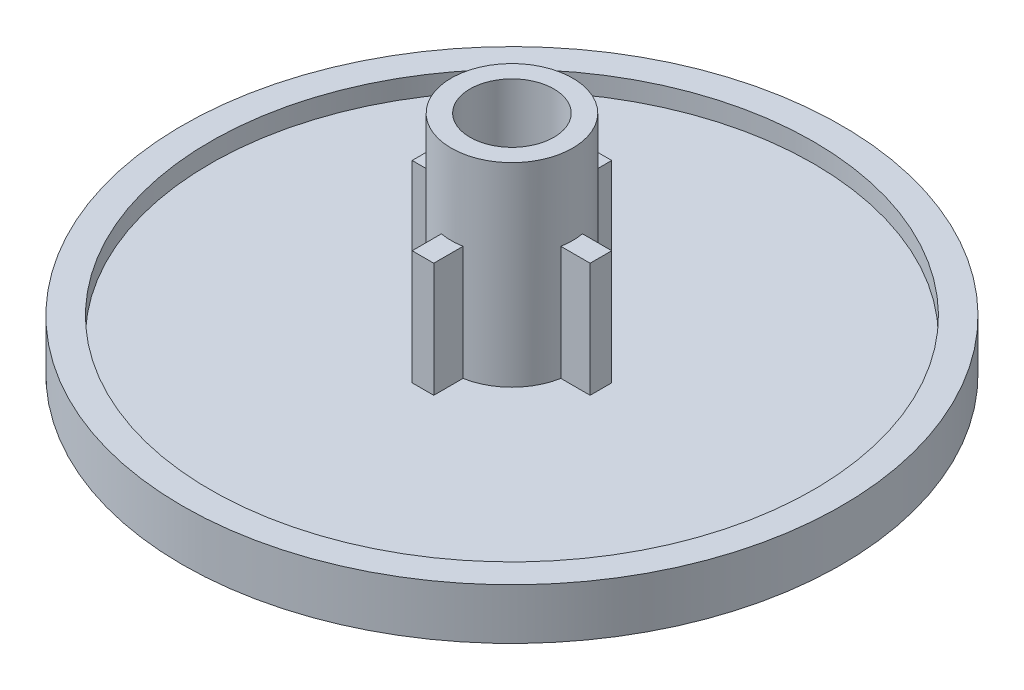
from build123d import *

# Parameters (mm, degrees)
SKETCH1_R           = 13.1699
BOSS_EXTRUDE1_DEPTH = 1.27
SKETCH2_R           = 13.1699
SKETCH2_R_2         = 12.0523
BOSS_EXTRUDE2_DEPTH = 0.762
SKETCH3_R           = 2.4257
BOSS_EXTRUDE3_DEPTH = 7.7724
SKETCH6_W           = 7.112
SKETCH6_H           = 5.842
BOSS_EXTRUDE4_DEPTH = 0.4318
SKETCH7_W           = 7.112
SKETCH7_H           = 5.842
BOSS_EXTRUDE5_DEPTH = 0.4318
SKETCH4_R           = 1.6764
CUT_EXTRUDE1_DEPTH  = 7.7724


with BuildPart() as part:
    # Sketch1 → Boss-Extrude1 (new body)
    with BuildSketch(Plane(origin=(0, 0, 0), x_dir=(1, 0, 0), z_dir=(0, 1, 0))):
        with Locations(Location((0, 0, 0), (0, 0, 270))):
            Circle(SKETCH1_R)
    extrude(amount=BOSS_EXTRUDE1_DEPTH)

    # Sketch2 → Boss-Extrude2 (add)
    with BuildSketch(Plane(origin=(0, 1.27, 0), x_dir=(1, 0, 0), z_dir=(0, 1, 0))):
        with Locations(Location((0, 0, 0), (0, 0, 270))):
            Circle(SKETCH2_R)
        with Locations(Location((0, 0, 0), (0, 0, 90))):
            Circle(SKETCH2_R_2, mode=Mode.SUBTRACT)
    extrude(amount=BOSS_EXTRUDE2_DEPTH)

    # Sketch3 → Boss-Extrude3 (add)
    with BuildSketch(Plane(origin=(0, 1.27, 0), x_dir=(1, 0, 0), z_dir=(0, 1, 0))):
        with Locations(Location((0, 0, 0), (0, 0, 90))):
            Circle(SKETCH3_R)
    extrude(amount=BOSS_EXTRUDE3_DEPTH)

    # Sketch6 → Boss-Extrude4 (add, symmetric)
    with BuildSketch(Plane.XY):
        with Locations((0, 2.921)):
            Rectangle(SKETCH6_W, SKETCH6_H)
    extrude(amount=BOSS_EXTRUDE4_DEPTH, both=True)

    # Sketch7 → Boss-Extrude5 (add, symmetric)
    with BuildSketch(Plane(origin=(0, 0, 0), x_dir=(0, 0, -1), z_dir=(1, 0, 0))):
        with Locations((0, 2.921)):
            Rectangle(SKETCH7_W, SKETCH7_H)
    extrude(amount=BOSS_EXTRUDE5_DEPTH, both=True)

    # Sketch4 → Cut-Extrude1 (cut)
    with BuildSketch(Plane(origin=(0, 9.0424, 0), x_dir=(1, 0, 0), z_dir=(0, 1, 0))):
        with Locations(Location((0, 0, 0), (0, 0, 270))):
            Circle(SKETCH4_R)
    extrude(amount=-CUT_EXTRUDE1_DEPTH, mode=Mode.SUBTRACT)


solid = part.part
